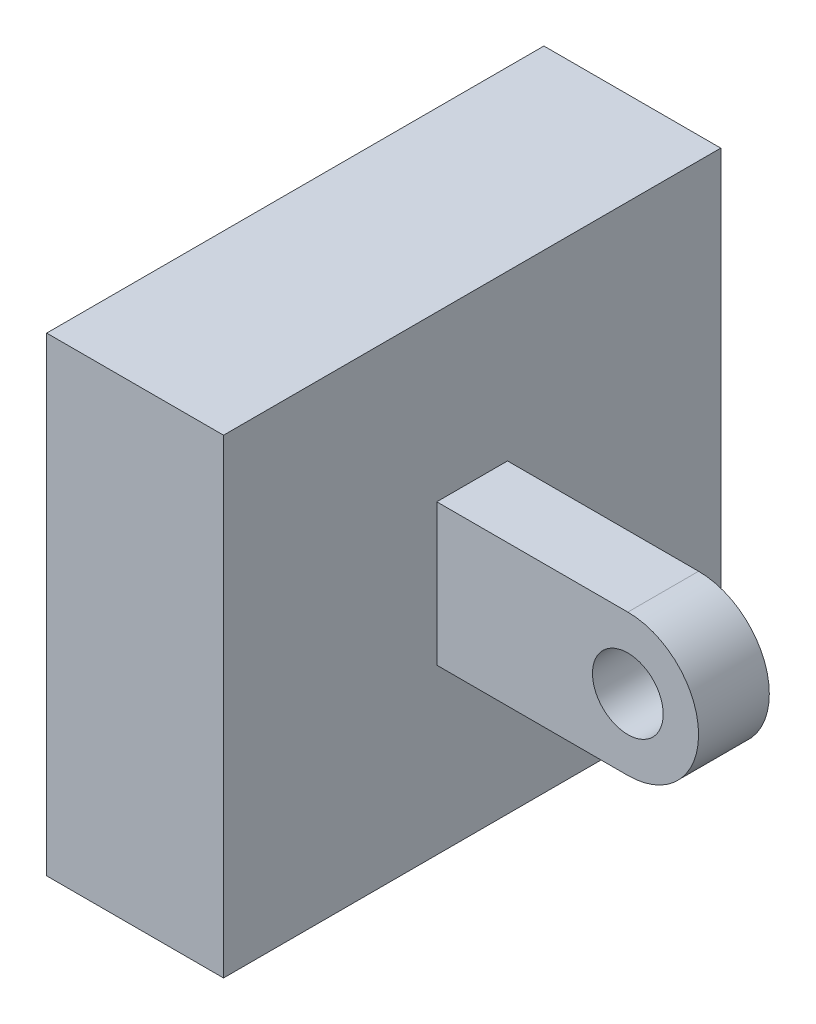
from build123d import *

# Parameters (mm, degrees)
EXTRUDE_1_DEPTH      = 20
EXTRUDE_1_DEPTH_BACK = 20
SKETCH_1_R           = 20
SKETCH_2_W           = 281.151719904
SKETCH_2_H           = 265.807540378
EXTRUDE_2_DEPTH      = 100
SKETCH_3_R           = 20
CUT_EXTRUDE_1_DEPTH  = 20


with BuildPart() as part:
    # 草图1 → 凸台-拉伸1 (new, two sides: drawn at the far end of the back side and taken through both)
    with BuildSketch(Plane.XY.offset(-EXTRUDE_1_DEPTH_BACK)):
        with BuildLine():
            Line((0, 40), (-108.026251169, 40))
            Line((-108.026251169, 40), (-108.026251169, -40))
            Line((-108.026251169, -40), (0, -40))
            ThreePointArc((0, -40), (40, 0), (0, 40))
        make_face()
        Circle(SKETCH_1_R, mode=Mode.SUBTRACT)
    extrude(amount=EXTRUDE_1_DEPTH + EXTRUDE_1_DEPTH_BACK)

    # 草图2 → 凸台-拉伸2 (add)
    with BuildSketch(Plane.ZY.offset(108.026251169)):
        Rectangle(SKETCH_2_W, SKETCH_2_H)
    extrude(amount=EXTRUDE_2_DEPTH)

    # 草图3 → 切除-拉伸1 (cut)
    with BuildSketch(Plane.ZY.offset(208.026251169)):
        Circle(SKETCH_3_R)
    extrude(amount=-CUT_EXTRUDE_1_DEPTH, mode=Mode.SUBTRACT)


solid = part.part
